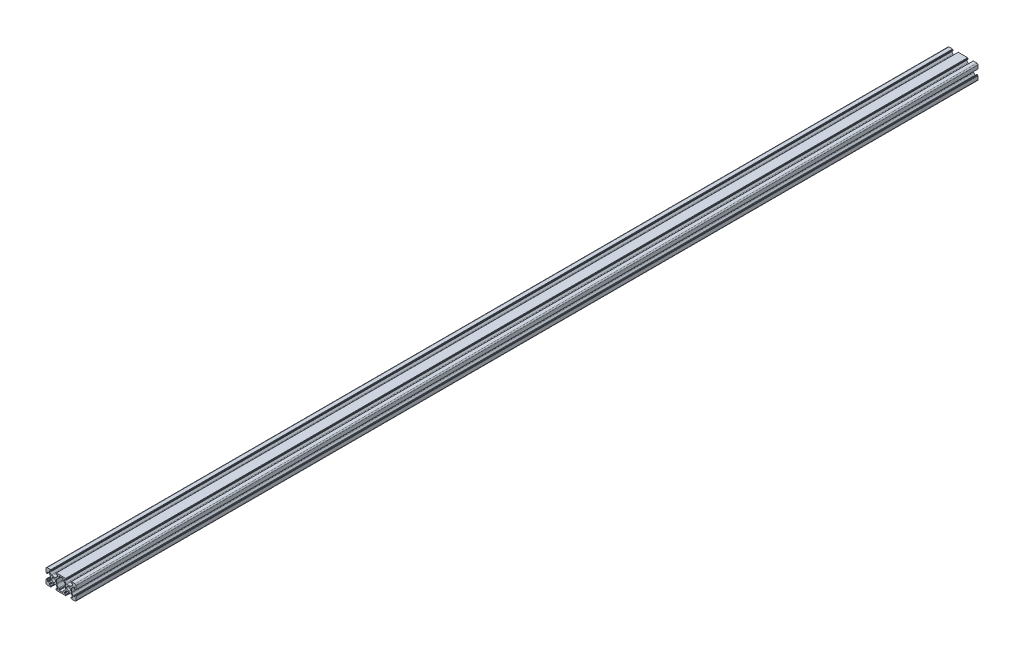
from build123d import *

# Parameters (mm, degrees)
SKETCH1_R           = 2.5
BOSS_EXTRUDE2_DEPTH = 1200


with BuildPart() as part:
    # Sketch1 → Boss-Extrude2 (new body)
    with BuildSketch(Plane.XY):
        with BuildLine():
            Line((1.5, 0), (6.2, 0))
            ThreePointArc((6.2, 0), (6.341421356, 0.058578644), (6.4, 0.2))
            Line((6.4, 0.2), (6.4, 0.3))
            ThreePointArc((6.4, 0.3), (6.458578644, 0.441421356), (6.6, 0.5))
            Line((6.6, 0.5), (6.7, 0.5))
            ThreePointArc((6.7, 0.5), (6.841421356, 0.558578644), (6.9, 0.7))
            Line((6.9, 0.7), (6.9, 1.5))
            ThreePointArc((6.9, 1.5), (6.812132034, 1.712132034), (6.6, 1.8))
            Line((6.6, 1.8), (4.8, 1.8))
            ThreePointArc((4.8, 1.8), (4.587867966, 1.887867966), (4.5, 2.1))
            Line((4.5, 2.1), (4.5, 2.818019485))
            ThreePointArc((4.5, 2.818019485), (4.614180701, 3.392044633), (4.939339828, 3.878679656))
            Line((4.939339828, 3.878679656), (6.721320344, 5.660660172))
            ThreePointArc((6.721320344, 5.660660172), (7.207955367, 5.985819299), (7.781980515, 6.1))
            Line((7.781980515, 6.1), (12.218019485, 6.1))
            ThreePointArc((12.218019485, 6.1), (12.792044633, 5.985819299), (13.278679656, 5.660660172))
            Line((13.278679656, 5.660660172), (15.060660172, 3.878679656))
            ThreePointArc((15.060660172, 3.878679656), (15.385819299, 3.392044633), (15.5, 2.818019485))
            Line((15.5, 2.818019485), (15.5, 2.1))
            ThreePointArc((15.5, 2.1), (15.412132034, 1.887867966), (15.2, 1.8))
            Line((15.2, 1.8), (13.4, 1.8))
            ThreePointArc((13.4, 1.8), (13.187867966, 1.712132034), (13.1, 1.5))
            Line((13.1, 1.5), (13.1, 0.7))
            ThreePointArc((13.1, 0.7), (13.158578644, 0.558578644), (13.3, 0.5))
            Line((13.3, 0.5), (13.4, 0.5))
            ThreePointArc((13.4, 0.5), (13.541421356, 0.441421356), (13.6, 0.3))
            Line((13.6, 0.3), (13.6, 0.2))
            ThreePointArc((13.6, 0.2), (13.658578644, 0.058578644), (13.8, 0))
            Line((13.8, 0), (26.2, 0))
            ThreePointArc((26.2, 0), (26.341421356, 0.058578644), (26.4, 0.2))
            Line((26.4, 0.2), (26.4, 0.3))
            ThreePointArc((26.4, 0.3), (26.458578644, 0.441421356), (26.6, 0.5))
            Line((26.6, 0.5), (26.7, 0.5))
            ThreePointArc((26.7, 0.5), (26.841421356, 0.558578644), (26.9, 0.7))
            Line((26.9, 0.7), (26.9, 1.5))
            ThreePointArc((26.9, 1.5), (26.812132034, 1.712132034), (26.6, 1.8))
            Line((26.6, 1.8), (24.8, 1.8))
            ThreePointArc((24.8, 1.8), (24.587867966, 1.887867966), (24.5, 2.1))
            Line((24.5, 2.1), (24.5, 2.818019485))
            ThreePointArc((24.5, 2.818019485), (24.614180701, 3.392044633), (24.939339828, 3.878679656))
            Line((24.939339828, 3.878679656), (26.721320344, 5.660660172))
            ThreePointArc((26.721320344, 5.660660172), (27.207955367, 5.985819299), (27.781980515, 6.1))
            Line((27.781980515, 6.1), (32.218019485, 6.1))
            ThreePointArc((32.218019485, 6.1), (32.792044633, 5.985819299), (33.278679656, 5.660660172))
            Line((33.278679656, 5.660660172), (35.060660172, 3.878679656))
            ThreePointArc((35.060660172, 3.878679656), (35.385819299, 3.392044633), (35.5, 2.818019485))
            Line((35.5, 2.818019485), (35.5, 2.1))
            ThreePointArc((35.5, 2.1), (35.412132034, 1.887867966), (35.2, 1.8))
            Line((35.2, 1.8), (33.4, 1.8))
            ThreePointArc((33.4, 1.8), (33.187867966, 1.712132034), (33.1, 1.5))
            Line((33.1, 1.5), (33.1, 0.7))
            ThreePointArc((33.1, 0.7), (33.158578644, 0.558578644), (33.3, 0.5))
            Line((33.3, 0.5), (33.4, 0.5))
            ThreePointArc((33.4, 0.5), (33.541421356, 0.441421356), (33.6, 0.3))
            Line((33.6, 0.3), (33.6, 0.2))
            ThreePointArc((33.6, 0.2), (33.658578644, 0.058578644), (33.8, 0))
            Line((33.8, 0), (38.5, 0))
            ThreePointArc((38.5, 0), (39.560660172, 0.439339828), (40, 1.5))
            Line((40, 1.5), (40, 6.2))
            ThreePointArc((40, 6.2), (39.941421356, 6.341421356), (39.8, 6.4))
            Line((39.8, 6.4), (39.7, 6.4))
            ThreePointArc((39.7, 6.4), (39.558578644, 6.458578644), (39.5, 6.6))
            Line((39.5, 6.6), (39.5, 6.7))
            ThreePointArc((39.5, 6.7), (39.441421356, 6.841421356), (39.3, 6.9))
            Line((39.3, 6.9), (38.5, 6.9))
            ThreePointArc((38.5, 6.9), (38.287867966, 6.812132034), (38.2, 6.6))
            Line((38.2, 6.6), (38.2, 4.8))
            ThreePointArc((38.2, 4.8), (38.112132034, 4.587867966), (37.9, 4.5))
            Line((37.9, 4.5), (37.181980515, 4.5))
            ThreePointArc((37.181980515, 4.5), (36.607955367, 4.614180701), (36.121320344, 4.939339828))
            Line((36.121320344, 4.939339828), (34.339339828, 6.721320344))
            ThreePointArc((34.339339828, 6.721320344), (34.014180701, 7.207955367), (33.9, 7.781980515))
            Line((33.9, 7.781980515), (33.9, 12.218019485))
            ThreePointArc((33.9, 12.218019485), (34.014180701, 12.792044633), (34.339339828, 13.278679656))
            Line((34.339339828, 13.278679656), (36.121320344, 15.060660172))
            ThreePointArc((36.121320344, 15.060660172), (36.607955367, 15.385819299), (37.181980515, 15.5))
            Line((37.181980515, 15.5), (37.9, 15.5))
            ThreePointArc((37.9, 15.5), (38.112132034, 15.412132034), (38.2, 15.2))
            Line((38.2, 15.2), (38.2, 13.4))
            ThreePointArc((38.2, 13.4), (38.287867966, 13.187867966), (38.5, 13.1))
            Line((38.5, 13.1), (39.3, 13.1))
            ThreePointArc((39.3, 13.1), (39.441421356, 13.158578644), (39.5, 13.3))
            Line((39.5, 13.3), (39.5, 13.4))
            ThreePointArc((39.5, 13.4), (39.558578644, 13.541421356), (39.7, 13.6))
            Line((39.7, 13.6), (39.8, 13.6))
            ThreePointArc((39.8, 13.6), (39.941421356, 13.658578644), (40, 13.8))
            Line((40, 13.8), (40, 18.5))
            ThreePointArc((40, 18.5), (39.560660172, 19.560660172), (38.5, 20))
            Line((38.5, 20), (33.8, 20))
            ThreePointArc((33.8, 20), (33.658578644, 19.941421356), (33.6, 19.8))
            Line((33.6, 19.8), (33.6, 19.7))
            ThreePointArc((33.6, 19.7), (33.541421356, 19.558578644), (33.4, 19.5))
            Line((33.4, 19.5), (33.3, 19.5))
            ThreePointArc((33.3, 19.5), (33.158578644, 19.441421356), (33.1, 19.3))
            Line((33.1, 19.3), (33.1, 18.5))
            ThreePointArc((33.1, 18.5), (33.187867966, 18.287867966), (33.4, 18.2))
            Line((33.4, 18.2), (35.2, 18.2))
            ThreePointArc((35.2, 18.2), (35.412132034, 18.112132034), (35.5, 17.9))
            Line((35.5, 17.9), (35.5, 17.181980515))
            ThreePointArc((35.5, 17.181980515), (35.385819299, 16.607955367), (35.060660172, 16.121320344))
            Line((35.060660172, 16.121320344), (33.278679656, 14.339339828))
            ThreePointArc((33.278679656, 14.339339828), (32.792044633, 14.014180701), (32.218019485, 13.9))
            Line((32.218019485, 13.9), (27.781980515, 13.9))
            ThreePointArc((27.781980515, 13.9), (27.207955367, 14.014180701), (26.721320344, 14.339339828))
            Line((26.721320344, 14.339339828), (24.939339828, 16.121320344))
            ThreePointArc((24.939339828, 16.121320344), (24.614180701, 16.607955367), (24.5, 17.181980515))
            Line((24.5, 17.181980515), (24.5, 17.9))
            ThreePointArc((24.5, 17.9), (24.587867966, 18.112132034), (24.8, 18.2))
            Line((24.8, 18.2), (26.6, 18.2))
            ThreePointArc((26.6, 18.2), (26.812132034, 18.287867966), (26.9, 18.5))
            Line((26.9, 18.5), (26.9, 19.3))
            ThreePointArc((26.9, 19.3), (26.841421356, 19.441421356), (26.7, 19.5))
            Line((26.7, 19.5), (26.6, 19.5))
            ThreePointArc((26.6, 19.5), (26.458578644, 19.558578644), (26.4, 19.7))
            Line((26.4, 19.7), (26.4, 19.8))
            ThreePointArc((26.4, 19.8), (26.341421356, 19.941421356), (26.2, 20))
            Line((26.2, 20), (13.8, 20))
            ThreePointArc((13.8, 20), (13.658578644, 19.941421356), (13.6, 19.8))
            Line((13.6, 19.8), (13.6, 19.7))
            ThreePointArc((13.6, 19.7), (13.541421356, 19.558578644), (13.4, 19.5))
            Line((13.4, 19.5), (13.3, 19.5))
            ThreePointArc((13.3, 19.5), (13.158578644, 19.441421356), (13.1, 19.3))
            Line((13.1, 19.3), (13.1, 18.2))
            Line((13.1, 18.2), (15.3, 18.2))
            ThreePointArc((15.3, 18.2), (15.512132034, 18.112132034), (15.6, 17.9))
            Line((15.6, 17.9), (15.6, 17.281980515))
            ThreePointArc((15.6, 17.281980515), (15.485819299, 16.707955367), (15.160660172, 16.221320344))
            Line((15.160660172, 16.221320344), (13.278679656, 14.339339828))
            ThreePointArc((13.278679656, 14.339339828), (12.792044633, 14.014180701), (12.218019485, 13.9))
            Line((12.218019485, 13.9), (7.986375635, 13.9))
            ThreePointArc((7.986375635, 13.9), (7.393381044, 14.022191082), (6.896997987, 14.36885678))
            Line((6.896997987, 14.36885678), (4.910622352, 16.467414163))
            ThreePointArc((4.910622352, 16.467414163), (4.606431474, 16.943609851), (4.5, 17.498557383))
            Line((4.5, 17.498557383), (4.5, 17.9))
            ThreePointArc((4.5, 17.9), (4.587867966, 18.112132034), (4.8, 18.2))
            Line((4.8, 18.2), (6.9, 18.2))
            Line((6.9, 18.2), (6.9, 19.3))
            ThreePointArc((6.9, 19.3), (6.841421356, 19.441421356), (6.7, 19.5))
            Line((6.7, 19.5), (6.6, 19.5))
            ThreePointArc((6.6, 19.5), (6.458578644, 19.558578644), (6.4, 19.7))
            Line((6.4, 19.7), (6.4, 19.8))
            ThreePointArc((6.4, 19.8), (6.341421356, 19.941421356), (6.2, 20))
            Line((6.2, 20), (1.5, 20))
            ThreePointArc((1.5, 20), (0.439339828, 19.560660172), (0, 18.5))
            Line((0, 18.5), (0, 13.8))
            ThreePointArc((0, 13.8), (0.058578644, 13.658578644), (0.2, 13.6))
            Line((0.2, 13.6), (0.3, 13.6))
            ThreePointArc((0.3, 13.6), (0.441421356, 13.541421356), (0.5, 13.4))
            Line((0.5, 13.4), (0.5, 13.3))
            ThreePointArc((0.5, 13.3), (0.558578644, 13.158578644), (0.7, 13.1))
            Line((0.7, 13.1), (1.5, 13.1))
            ThreePointArc((1.5, 13.1), (1.712132034, 13.187867966), (1.8, 13.4))
            Line((1.8, 13.4), (1.8, 15.2))
            ThreePointArc((1.8, 15.2), (1.887867966, 15.412132034), (2.1, 15.5))
            Line((2.1, 15.5), (2.818019485, 15.5))
            ThreePointArc((2.818019485, 15.5), (3.392044633, 15.385819299), (3.878679656, 15.060660172))
            Line((3.878679656, 15.060660172), (5.660660172, 13.278679656))
            ThreePointArc((5.660660172, 13.278679656), (5.985819299, 12.792044633), (6.1, 12.218019485))
            Line((6.1, 12.218019485), (6.1, 7.781980515))
            ThreePointArc((6.1, 7.781980515), (5.985819299, 7.207955367), (5.660660172, 6.721320344))
            Line((5.660660172, 6.721320344), (3.878679656, 4.939339828))
            ThreePointArc((3.878679656, 4.939339828), (3.392044633, 4.614180701), (2.818019485, 4.5))
            Line((2.818019485, 4.5), (2.1, 4.5))
            ThreePointArc((2.1, 4.5), (1.887867966, 4.587867966), (1.8, 4.8))
            Line((1.8, 4.8), (1.8, 6.6))
            ThreePointArc((1.8, 6.6), (1.712132034, 6.812132034), (1.5, 6.9))
            Line((1.5, 6.9), (0.7, 6.9))
            ThreePointArc((0.7, 6.9), (0.558578644, 6.841421356), (0.5, 6.7))
            Line((0.5, 6.7), (0.5, 6.6))
            ThreePointArc((0.5, 6.6), (0.441421356, 6.458578644), (0.3, 6.4))
            Line((0.3, 6.4), (0.2, 6.4))
            ThreePointArc((0.2, 6.4), (0.058578644, 6.341421356), (0, 6.2))
            Line((0, 6.2), (0, 1.5))
            ThreePointArc((0, 1.5), (0.439339828, 0.439339828), (1.5, 0))
        make_face()
        with Locations((10, 10)):
            Circle(SKETCH1_R, mode=Mode.SUBTRACT)
        with Locations((30, 10)):
            Circle(SKETCH1_R, mode=Mode.SUBTRACT)
        with BuildLine():
            Line((17.6, 1.8), (22.4, 1.8))
            ThreePointArc((22.4, 1.8), (22.612132034, 1.887867966), (22.7, 2.1))
            Line((22.7, 2.1), (22.7, 3.139339828))
            ThreePointArc((22.7, 3.139339828), (22.814180701, 3.713364977), (23.139339828, 4.2))
            Line((23.139339828, 4.2), (25.660660172, 6.721320344))
            ThreePointArc((25.660660172, 6.721320344), (25.985819299, 7.207955367), (26.1, 7.781980515))
            Line((26.1, 7.781980515), (26.1, 12.218019485))
            ThreePointArc((26.1, 12.218019485), (25.985819299, 12.792044633), (25.660660172, 13.278679656))
            Line((25.660660172, 13.278679656), (23.139339828, 15.8))
            ThreePointArc((23.139339828, 15.8), (22.814180701, 16.286635023), (22.7, 16.860660172))
            Line((22.7, 16.860660172), (22.7, 17.9))
            ThreePointArc((22.7, 17.9), (22.612132034, 18.112132034), (22.4, 18.2))
            Line((22.4, 18.2), (17.6, 18.2))
            ThreePointArc((17.6, 18.2), (17.387867966, 18.112132034), (17.3, 17.9))
            Line((17.3, 17.9), (17.3, 16.860660172))
            ThreePointArc((17.3, 16.860660172), (17.185819299, 16.286635023), (16.860660172, 15.8))
            Line((16.860660172, 15.8), (14.339339828, 13.278679656))
            ThreePointArc((14.339339828, 13.278679656), (14.014180701, 12.792044633), (13.9, 12.218019485))
            Line((13.9, 12.218019485), (13.9, 7.781980515))
            ThreePointArc((13.9, 7.781980515), (14.014180701, 7.207955367), (14.339339828, 6.721320344))
            Line((14.339339828, 6.721320344), (16.860660172, 4.2))
            ThreePointArc((16.860660172, 4.2), (17.185819299, 3.713364977), (17.3, 3.139339828))
            Line((17.3, 3.139339828), (17.3, 2.1))
            ThreePointArc((17.3, 2.1), (17.387867966, 1.887867966), (17.6, 1.8))
        make_face(mode=Mode.SUBTRACT)
    extrude(amount=BOSS_EXTRUDE2_DEPTH)


solid = part.part
